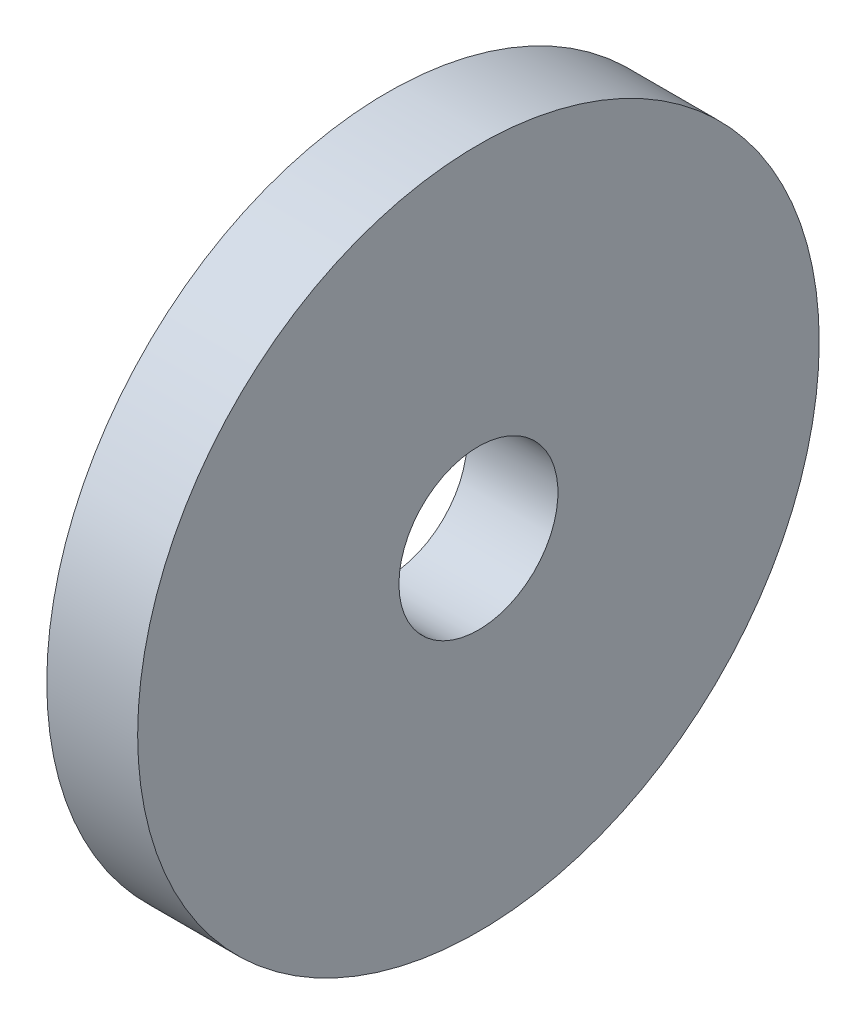
from build123d import *

# Parameters (mm, degrees)
ESQUISSE1_W = 4
ESQUISSE1_H = 11.5


with BuildPart() as part:
    # Esquisse1 → Base-Révolution (revolve)
    with BuildSketch(Plane.XY, mode=Mode.PRIVATE) as base_r_volution_sk:
        with Locations((2, 9.75)):
            Rectangle(ESQUISSE1_W, ESQUISSE1_H)
    revolve(base_r_volution_sk.sketch.rotate(Axis((-12.574722565, 0.5, 0), (1, 0, 0)), 90), axis=Axis((-12.574722565, 0.5, 0), (1, 0, 0)))


solid = part.part
